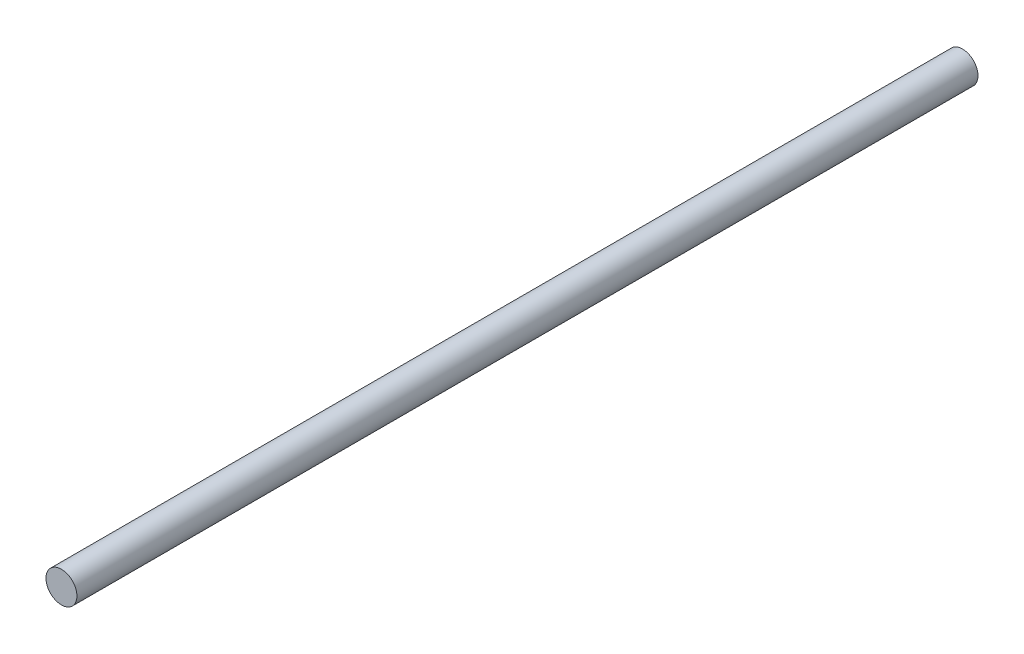
from build123d import *

# Parameters (mm, degrees)
SKETCH1_R           = 3.175
BOSS_EXTRUDE1_DEPTH = 184.912


with BuildPart() as part:
    # Sketch1 → Boss-Extrude1 (new body)
    with BuildSketch(Plane.XY):
        Circle(SKETCH1_R)
    extrude(amount=BOSS_EXTRUDE1_DEPTH)


solid = part.part
